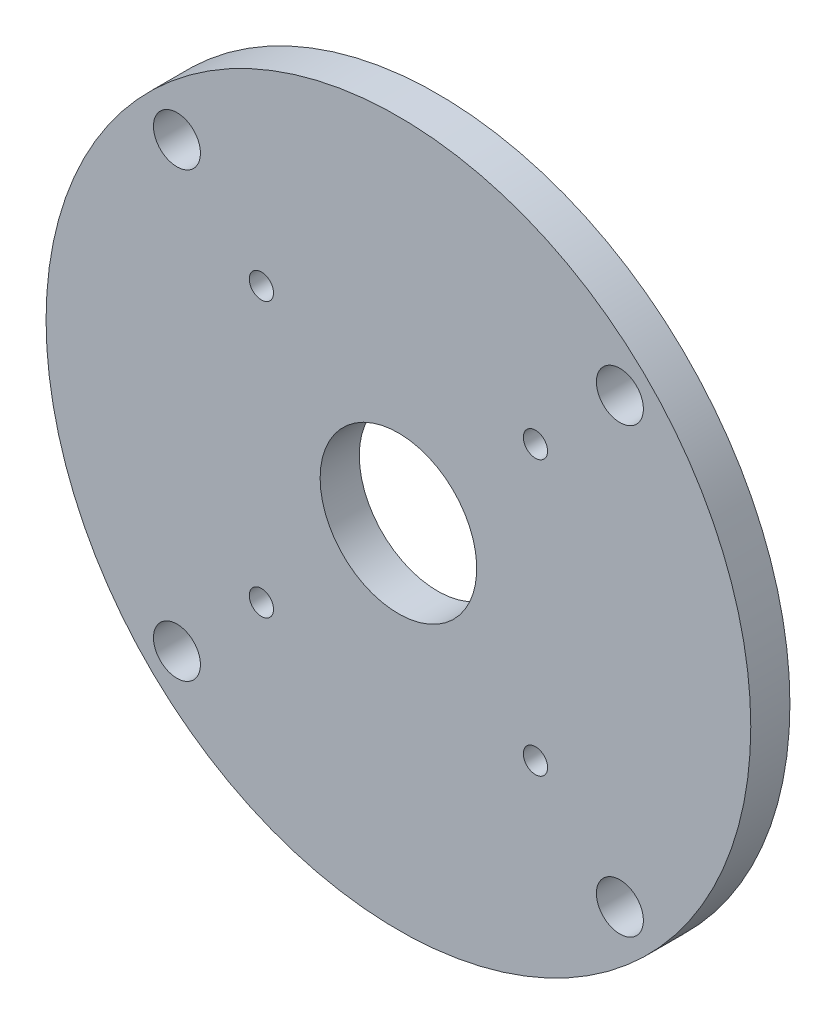
from build123d import *

# Parameters (mm, degrees)
SKETCH3_R           = 57.15
BOSS_EXTRUDE2_DEPTH = 6.35
SKETCH4_R           = 3.81
SKETCH4_R_2         = 12.7
CUT_EXTRUDE1_DEPTH  = 6.35
SKETCH5_R           = 1.9685
CUT_EXTRUDE2_DEPTH  = 6.35


with BuildPart() as part:
    # Sketch3 → Boss-Extrude2 (new body)
    with BuildSketch(Plane.XY):
        Circle(SKETCH3_R)
    extrude(amount=BOSS_EXTRUDE2_DEPTH)

    # Sketch4 → Cut-Extrude1 (cut)
    with BuildSketch(Plane(origin=(0, 0, 0), x_dir=(-1, 0, 0), z_dir=(0, 0, -1))):
        with Locations((-35.921024484, 35.921024484)):
            Circle(SKETCH4_R)
        with Locations((35.921024484, 35.921024484)):
            Circle(SKETCH4_R)
        with Locations((35.921024484, -35.921024484)):
            Circle(SKETCH4_R)
        with Locations((-35.921024484, -35.921024484)):
            Circle(SKETCH4_R)
        Circle(SKETCH4_R_2)
    extrude(amount=-CUT_EXTRUDE1_DEPTH, mode=Mode.SUBTRACT)

    # Sketch5 → Cut-Extrude2 (cut)
    with BuildSketch(Plane.XY.offset(6.35)):
        with Locations((-22.225, 22.225)):
            Circle(SKETCH5_R)
        with Locations((22.225, 22.225)):
            Circle(SKETCH5_R)
        with Locations((22.225, -22.225)):
            Circle(SKETCH5_R)
        with Locations((-22.225, -22.225)):
            Circle(SKETCH5_R)
    extrude(amount=-CUT_EXTRUDE2_DEPTH, mode=Mode.SUBTRACT)


solid = part.part
